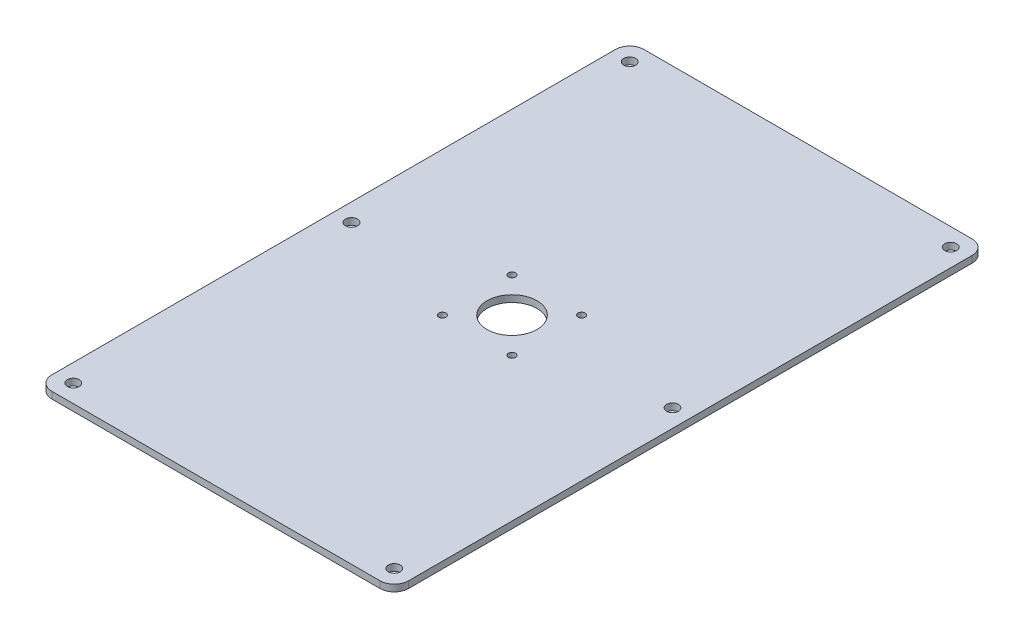
from build123d import *

# Parameters (mm, degrees)
SKETCH1_W                = 158.75
SKETCH1_H                = 263.525
BOSS_EXTRUDE1_DEPTH      = 3
SKETCH5_R                = 11.1125
CUT_EXTRUDE1_DEPTH       = 154.853004622
M3_CLEARANCE_HOLE1_D     = 3.2
M3_CLEARANCE_HOLE1_DEPTH = 3
M5_CLEARANCE_HOLE2_D     = 5.3
M5_CLEARANCE_HOLE2_DEPTH = 3
FILLET1_R                = 6.35


with BuildPart() as part:
    # Sketch1 → Boss-Extrude1 (new body)
    with BuildSketch(Plane(origin=(0, 0, 0), x_dir=(1, 0, 0), z_dir=(0, 1, 0))):
        Rectangle(SKETCH1_W, SKETCH1_H)
    extrude(amount=BOSS_EXTRUDE1_DEPTH)

    # Sketch5 → Cut-Extrude1 (cut, through all)
    with BuildSketch(Plane(origin=(0, 3, 0), x_dir=(1, 0, 0), z_dir=(0, 1, 0))):
        with Locations(Location((0, 0, 0), (0, 0, 270))):
            Circle(SKETCH5_R)
    extrude(amount=-CUT_EXTRUDE1_DEPTH, mode=Mode.SUBTRACT)

    # M3 Clearance Hole1
    with Locations(Plane(origin=(0, 3, 0), x_dir=(1, 0, 0), z_dir=(0, 1, 0))):
        with Locations((0, 0), (15.5, 15.5), (-15.5, -15.5), (-15.5, 15.5), (15.5, -15.5)):
            Hole(M3_CLEARANCE_HOLE1_D / 2, depth=M3_CLEARANCE_HOLE1_DEPTH)

    # M5 Clearance Hole2
    with Locations(Plane(origin=(0, 3, 0), x_dir=(1, 0, 0), z_dir=(0, 1, 0))):
        with Locations((0, 0), (71.4375, 123.825), (-71.4375, -123.825), (-71.4375, 123.825), (71.4375, -123.825), (-71.4375, 0), (71.4375, 0)):
            Hole(M5_CLEARANCE_HOLE2_D / 2, depth=M5_CLEARANCE_HOLE2_DEPTH)

    # Fillet1
    fillet1_edges = [part.edges().sort_by_distance(p)[0] for p in [
        (79.375, 1.5, 131.7625),
        (-79.375, 1.5, 131.7625),
        (-79.375, 1.5, -131.7625),
        (79.375, 1.5, -131.7625),
    ]]
    fillet(fillet1_edges, radius=FILLET1_R)


solid = part.part
